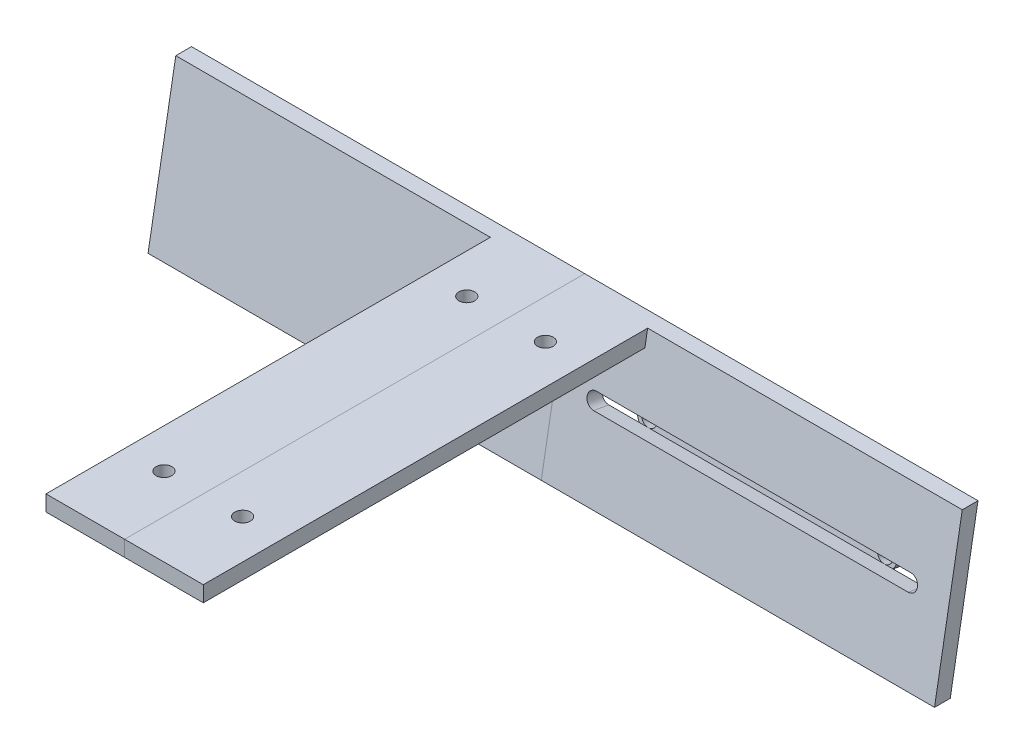
from build123d import *

# Parameters (mm, degrees)
BOSS_EXTRUDE1_DEPTH = 10
BOSS_EXTRUDE2_DEPTH = 50
SKETCH2_R           = 1
CUT_EXTRUDE1_DEPTH  = 50
CUT_EXTRUDE2_DEPTH  = 2
SKETCH3_3_R         = 1
BOSS_EXTRUDE3_DEPTH = 1.5
CUT_EXTRUDE3_DEPTH  = 0.2


with BuildPart() as part:
    # Sketch1 → Boss-Extrude1 (new body)
    with BuildSketch(Plane(origin=(0, 0, 0), x_dir=(0, 0, -1), z_dir=(1, 0, 0))):
        Polygon((-52.973460386, 18), (3.173885653, 18), (3.526539614, 20), (-52.973460386, 20), align=None)
    extrude(amount=BOSS_EXTRUDE1_DEPTH)

    # Sketch1<3> → Boss-Extrude2 (add)
    with BuildSketch(Plane(origin=(0, 0, 0), x_dir=(0, 0, -1), z_dir=(1, 0, 0))):
        Polygon((3.173885653, 18), (0, 0), (2, 0), (5.526539614, 20), (3.526539614, 20), align=None)
    extrude(amount=BOSS_EXTRUDE2_DEPTH)

    # Sketch2 → Cut-Extrude1 (cut)
    with BuildSketch(Plane(origin=(0, 20, 0), x_dir=(1, 0, 0), z_dir=(0, 1, 0))):
        with Locations(Location((5, -42.973460386, 0), (0, 0, 270))):
            Circle(SKETCH2_R)
        with Locations(Location((5, -4.473460386, 0), (0, 0, 270))):
            Circle(SKETCH2_R)
    extrude(amount=-CUT_EXTRUDE1_DEPTH, mode=Mode.SUBTRACT)


with BuildPart() as body_2:
    # Mirror1: mirrored copy
    add(part.part.mirror(Plane(origin=(0, 0, 0), x_dir=(0, 0, 1), z_dir=(1, 0, 0))))


with BuildPart() as part_1:
    add(part.part)

    # Sketch3 → Cut-Extrude2 (cut)
    with BuildSketch(Plane(origin=(0, -0.342020143, -1.939692621), x_dir=(-1, 0, 0), z_dir=(0, -0.1736481776669341, -0.9848077530122075))):
        with BuildLine():
            ThreePointArc((-41.118033989, 9.501562474), (-41.5, 10.501562474), (-41.118033989, 11.501562474))
            Line((-41.118033989, 11.501562474), (-45, 11.501562474))
            ThreePointArc((-45, 11.501562474), (-46, 10.501562474), (-45, 9.501562474))
            Line((-45, 9.501562474), (-41.118033989, 9.501562474))
        make_face()
        with BuildLine():
            ThreePointArc((-40, 9.501562474), (-41, 10.501562474), (-40, 11.501562474))
            Line((-40, 11.501562474), (-41.118033989, 11.501562474))
            ThreePointArc((-41.118033989, 11.501562474), (-41.5, 10.501562474), (-41.118033989, 9.501562474))
            Line((-41.118033989, 9.501562474), (-40, 9.501562474))
        make_face()
        with BuildLine():
            Line((-38.881966011, 11.501562474), (-40, 11.501562474))
            ThreePointArc((-40, 11.501562474), (-39.292893219, 11.208669255), (-39, 10.501562474))
            ThreePointArc((-39, 10.501562474), (-39.292893219, 9.794455693), (-40, 9.501562474))
            Line((-40, 9.501562474), (-38.881966011, 9.501562474))
            ThreePointArc((-38.881966011, 9.501562474), (-38.598741462, 9.96632934), (-38.5, 10.501562474))
            ThreePointArc((-38.5, 10.501562474), (-38.598741462, 11.036795609), (-38.881966011, 11.501562474))
        make_face()
        with BuildLine():
            ThreePointArc((-39, 10.501562474), (-39.292893219, 11.208669255), (-40, 11.501562474))
            Line((-40, 11.501562474), (-40, 9.501562474))
            ThreePointArc((-40, 9.501562474), (-39.292893219, 9.794455693), (-39, 10.501562474))
        make_face()
        with BuildLine():
            Line((-40, 9.501562474), (-40, 11.501562474))
            ThreePointArc((-40, 11.501562474), (-41, 10.501562474), (-40, 9.501562474))
        make_face()
        with BuildLine():
            Line((-11.118033989, 11.501562474), (-38.881966011, 11.501562474))
            ThreePointArc((-38.881966011, 11.501562474), (-38.598741462, 11.036795609), (-38.5, 10.501562474))
            ThreePointArc((-38.5, 10.501562474), (-38.598741462, 9.96632934), (-38.881966011, 9.501562474))
            Line((-38.881966011, 9.501562474), (-11.118033989, 9.501562474))
            ThreePointArc((-11.118033989, 9.501562474), (-11.5, 10.501562474), (-11.118033989, 11.501562474))
        make_face()
        with BuildLine():
            ThreePointArc((-10, 9.501562474), (-11, 10.501562477), (-9.999999995, 11.501562474))
            Line((-9.999999995, 11.501562474), (-11.118033989, 11.501562474))
            ThreePointArc((-11.118033989, 11.501562474), (-11.5, 10.501562474), (-11.118033989, 9.501562474))
            Line((-11.118033989, 9.501562474), (-10, 9.501562474))
        make_face()
        with BuildLine():
            Line((-8.881966011, 11.501562474), (-9.999999995, 11.501562474))
            ThreePointArc((-9.999999995, 11.501562474), (-9.292893217, 11.208669254), (-9, 10.501562474))
            ThreePointArc((-9, 10.501562474), (-9.292893219, 9.794455693), (-10, 9.501562474))
            Line((-10, 9.501562474), (-8.881966011, 9.501562474))
            ThreePointArc((-8.881966011, 9.501562474), (-8.598741462, 9.96632934), (-8.5, 10.501562474))
            ThreePointArc((-8.5, 10.501562474), (-8.598741462, 11.036795609), (-8.881966011, 11.501562474))
        make_face()
        with BuildLine():
            ThreePointArc((-9, 10.501562474), (-9.292893217, 11.208669254), (-9.999999995, 11.501562474))
            Line((-10, 11.501562474), (-10, 9.501562474))
            ThreePointArc((-10, 9.501562474), (-9.292893219, 9.794455693), (-9, 10.501562474))
        make_face()
        with BuildLine():
            Line((-10, 9.501562474), (-10, 11.501562474))
            ThreePointArc((-9.999999995, 11.501562474), (-11, 10.501562477), (-10, 9.501562474))
        make_face()
        with BuildLine():
            Line((-5, 11.501562474), (-8.881966011, 11.501562474))
            ThreePointArc((-8.881966011, 11.501562474), (-8.598741462, 11.036795609), (-8.5, 10.501562474))
            ThreePointArc((-8.5, 10.501562474), (-8.598741462, 9.96632934), (-8.881966011, 9.501562474))
            Line((-8.881966011, 9.501562474), (-5, 9.501562474))
            ThreePointArc((-5, 9.501562474), (-4, 10.501562474), (-5, 11.501562474))
        make_face()
    extrude(amount=-CUT_EXTRUDE2_DEPTH, mode=Mode.SUBTRACT)


with BuildPart() as body_3:
    # Sketch3<3> → Boss-Extrude3 (new body)
    with BuildSketch(Plane(origin=(0, -0.342020143, -1.939692621), x_dir=(-1, 0, 0), z_dir=(0, -0.1736481776669341, -0.9848077530122075))):
        with BuildLine():
            ThreePointArc((-10, 9.001562474), (-8.5, 10.501562474), (-10, 12.001562474))
            Line((-10, 12.001562474), (-10, 16.501562474))
            Line((-10, 16.501562474), (-40, 16.501562474))
            Line((-40, 16.501562474), (-40, 12.001562474))
            ThreePointArc((-40, 12.001562474), (-41.5, 10.501562474), (-40, 9.001562474))
            Line((-40, 9.001562474), (-40, 4.501562474))
            Line((-40, 4.501562474), (-10, 4.501562474))
            Line((-10, 4.501562474), (-10, 9.001562474))
        make_face()
        with Locations(Location((-40, 10.501562474, 0), (0, 0, 90))):
            Circle(SKETCH3_3_R, mode=Mode.SUBTRACT)
        with Locations(Location((-10, 10.501562474, 0), (0, 0, 90))):
            Circle(SKETCH3_3_R, mode=Mode.SUBTRACT)
    extrude(amount=BOSS_EXTRUDE3_DEPTH)

    # Sketch4 → Cut-Extrude3 (cut)
    # profile 1 of 6: a face of its own
    with BuildSketch(Plane(origin=(0, -0.60249241, -3.41690425), x_dir=(-1, 0, 0), z_dir=(0, -0.17364817766693416, -0.9848077530122075))):
        with BuildLine():
            Line((-39.91025641, 5.176742763), (-39.614383013, 5.354126577))
            add(Edge.make_bspline(
                [(-39.614383013, 5.354126577), (-39.586864776, 5.308062192), (-39.534140895, 5.219804608), (-39.446189536, 5.100546567), (-39.355056625, 4.999184411), (-39.260067291, 4.916307803), (-39.161801343, 4.851058916), (-39.059617289, 4.804856685), (-38.953859479, 4.776040709), (-38.881885657, 4.772540623), (-38.845953526, 4.770793243)],
                knots=[0, 0, 0, 0, 1.272034388, 2.437168799, 3.508375237, 4.49857839, 5.41946034, 6.295179144, 7.148887113, 8, 8, 8, 8], degree=3))
            add(Edge.make_bspline(
                [(-38.845953526, 4.770793243), (-38.815266665, 4.771647916), (-38.754429892, 4.773342306), (-38.664867649, 4.789623108), (-38.577885847, 4.814635237), (-38.495277209, 4.850456169), (-38.418181595, 4.893794654), (-38.350574899, 4.946140832), (-38.292128786, 5.004747038), (-38.244319672, 5.070129692), (-38.207639636, 5.140446841), (-38.179447568, 5.212622792), (-38.163802494, 5.28779136), (-38.161445741, 5.338401823), (-38.16025641, 5.363942282)],
                knots=[0, 0, 0, 0, 1.095163259, 2.171163733, 3.241058638, 4.321873601, 5.38011039, 6.391990106, 7.366004449, 8.327778327, 9.272591725, 10.192022065, 11.087607919, 12, 12, 12, 12], degree=3))
            add(Edge.make_bspline(
                [(-38.16025641, 5.363942282), (-38.161730721, 5.393083132), (-38.164727779, 5.452322221), (-38.190059259, 5.539721874), (-38.229908506, 5.626214444), (-38.26667115, 5.679715709), (-38.285757212, 5.707491961)],
                knots=[0, 0, 0, 0, 0.938893495, 1.908633276, 2.914225137, 4, 4, 4, 4], degree=3))
            add(Edge.make_bspline(
                [(-38.285757212, 5.707491961), (-38.301427826, 5.727538785), (-38.33432632, 5.769624584), (-38.390883833, 5.832269819), (-38.457249947, 5.896888238), (-38.531153502, 5.965947295), (-38.615286591, 6.036235092), (-38.707014105, 6.11110337), (-38.808677964, 6.187704947), (-38.879977461, 6.239077512), (-38.916766827, 6.26558491)],
                knots=[0, 0, 0, 0, 0.722233717, 1.516239348, 2.393582979, 3.351407094, 4.387010283, 5.505090956, 6.712668013, 8, 8, 8, 8], degree=3))
            add(Edge.make_bspline(
                [(-38.916766827, 6.26558491), (-38.953590823, 6.291813498), (-39.0239955, 6.34196056), (-39.122454082, 6.416384844), (-39.210498545, 6.484428714), (-39.287737562, 6.546732726), (-39.354137158, 6.60330533), (-39.410220569, 6.653603269), (-39.454559127, 6.69898683), (-39.479214707, 6.728428172), (-39.490284455, 6.741646609)],
                knots=[0, 0, 0, 0, 1.452282411, 2.77665338, 3.964542531, 5.026858415, 5.96415736, 6.766646006, 7.446254459, 8, 8, 8, 8], degree=3))
            add(Edge.make_bspline(
                [(-39.490284455, 6.741646609), (-39.505757, 6.762247646), (-39.536185837, 6.802762349), (-39.576351843, 6.866087207), (-39.610491005, 6.930910473), (-39.637253337, 6.997406337), (-39.659789556, 7.064641266), (-39.674947487, 7.133492512), (-39.684438884, 7.20365113), (-39.68541087, 7.250864631), (-39.685897436, 7.274499173)],
                knots=[0, 0, 0, 0, 1.068054152, 2.10047183, 3.106115577, 4.101338837, 5.06977816, 6.043150881, 7.020423561, 8, 8, 8, 8], degree=3))
            add(Edge.make_bspline(
                [(-39.685897436, 7.274499173), (-39.684592227, 7.311528947), (-39.682009707, 7.384797011), (-39.66016919, 7.491827842), (-39.625696296, 7.594014259), (-39.577401408, 7.690344593), (-39.515144055, 7.778310573), (-39.443098081, 7.85892406), (-39.357286595, 7.926692643), (-39.263133971, 7.985904701), (-39.160077599, 8.032250626), (-39.052086696, 8.067211606), (-38.938989624, 8.087020864), (-38.862386489, 8.089863629), (-38.823517628, 8.091306064)],
                knots=[0, 0, 0, 0, 1.005424448, 1.989358655, 2.955360095, 3.929531133, 4.905563448, 5.876582895, 6.856512386, 7.866279853, 8.892233794, 9.918561126, 10.94386622, 12, 12, 12, 12], degree=3))
            add(Edge.make_bspline(
                [(-38.823517628, 8.091306064), (-38.782273528, 8.089883512), (-38.700252176, 8.087054511), (-38.579602961, 8.06245698), (-38.463442244, 8.021756308), (-38.369998979, 7.97556765), (-38.296866218, 7.929436234), (-38.241093485, 7.88741641), (-38.184576034, 7.839041302), (-38.12685798, 7.784182055), (-38.06891732, 7.722335304), (-38.009893868, 7.653924615), (-37.949649599, 7.57936806), (-37.910893739, 7.526143559), (-37.891025641, 7.498858147)],
                knots=[0, 0, 0, 0, 1.286793592, 2.559021753, 3.825965368, 5.121522368, 5.803751409, 6.523245864, 7.299691795, 8.125521123, 9.008227632, 9.944561021, 10.946284179, 12, 12, 12, 12], degree=3))
            Line((-37.891025641, 7.498858147), (-38.174979968, 7.283613756))
            add(Edge.make_bspline(
                [(-38.174979968, 7.283613756), (-38.1921259, 7.305702447), (-38.225144957, 7.3482401), (-38.275274444, 7.407811415), (-38.322523092, 7.462227895), (-38.369073492, 7.509493023), (-38.412467124, 7.552195156), (-38.454584166, 7.588754913), (-38.494818517, 7.619530509), (-38.545535428, 7.652374069), (-38.609253146, 7.684930572), (-38.689237682, 7.71247965), (-38.772823957, 7.729034712), (-38.829753589, 7.7312236), (-38.858573718, 7.732331705)],
                knots=[0, 0, 0, 0, 1.181633172, 2.275549214, 3.290209073, 4.226197932, 5.078386478, 5.862611352, 6.581680152, 7.217281963, 8.414376989, 9.595101626, 10.782541182, 12, 12, 12, 12], degree=3))
            add(Edge.make_bspline(
                [(-38.858573718, 7.732331705), (-38.89473024, 7.731120005), (-38.964454688, 7.728783356), (-39.063444924, 7.703263371), (-39.152538849, 7.66308151), (-39.229091414, 7.606766532), (-39.292828391, 7.540045539), (-39.33893385, 7.463266684), (-39.366684014, 7.378484282), (-39.370070294, 7.319342625), (-39.371794872, 7.289222731)],
                knots=[0, 0, 0, 0, 1.14458467, 2.207223713, 3.21896685, 4.227309161, 5.202851033, 6.127160689, 7.046193047, 8, 8, 8, 8], degree=3))
            add(Edge.make_bspline(
                [(-39.371794872, 7.289222731), (-39.371401745, 7.270471252), (-39.370614849, 7.232937633), (-39.359640051, 7.177486211), (-39.345540722, 7.122174871), (-39.323198091, 7.067252288), (-39.292352787, 7.011757929), (-39.251847611, 6.954736192), (-39.200834299, 6.895684483), (-39.161757287, 6.857277109), (-39.141125801, 6.836999173)],
                knots=[0, 0, 0, 0, 0.858281714, 1.717966888, 2.583508476, 3.4729293, 4.427298488, 5.488583878, 6.674047936, 8, 8, 8, 8], degree=3))
            add(Edge.make_bspline(
                [(-39.141125801, 6.836999173), (-39.133464429, 6.830162147), (-39.115262762, 6.813918939), (-39.081986836, 6.787326658), (-39.038044038, 6.754523886), (-38.984581837, 6.713936569), (-38.920614475, 6.666855107), (-38.846134919, 6.613881495), (-38.761973386, 6.553296036), (-38.70225147, 6.510938495), (-38.670673077, 6.488541641)],
                knots=[0, 0, 0, 0, 0.420754252, 0.999615792, 1.744751191, 2.668019286, 3.750313428, 4.999500688, 6.413464383, 8, 8, 8, 8], degree=3))
            add(Edge.make_bspline(
                [(-38.670673077, 6.488541641), (-38.632687164, 6.460900281), (-38.559132707, 6.40737662), (-38.454475127, 6.32696094), (-38.359581319, 6.248313171), (-38.274118116, 6.171935564), (-38.197241207, 6.098407471), (-38.129803487, 6.026844291), (-38.071117806, 5.957758718), (-38.007938588, 5.869186142), (-37.943380768, 5.760405058), (-37.887939261, 5.627126819), (-37.852980913, 5.493330499), (-37.848409398, 5.403403662), (-37.846153846, 5.359034429)],
                knots=[0, 0, 0, 0, 1.163667725, 2.253281268, 3.268753668, 4.215851969, 5.092017293, 5.902905408, 6.650798638, 7.335211899, 8.59617414, 9.77448103, 10.901945474, 12, 12, 12, 12], degree=3))
            add(Edge.make_bspline(
                [(-37.846153846, 5.359034429), (-37.846810984, 5.327656064), (-37.848112499, 5.265508681), (-37.863073413, 5.174253604), (-37.884993078, 5.085622734), (-37.918030312, 5.000711622), (-37.95835347, 4.917966859), (-38.009519718, 4.839558959), (-38.068827403, 4.76375256), (-38.136861168, 4.692569069), (-38.21130707, 4.627222873), (-38.289990765, 4.569093811), (-38.373041038, 4.520625488), (-38.460007355, 4.481074646), (-38.550909691, 4.450141128), (-38.645717475, 4.427728259), (-38.744586986, 4.413972548), (-38.811787468, 4.412544787), (-38.845953526, 4.411818884)],
                knots=[0, 0, 0, 0, 0.983748083, 1.948392443, 2.894712957, 3.844097841, 4.80183111, 5.778335162, 6.776009319, 7.81870978, 8.863265674, 9.881300176, 10.883814829, 11.87499822, 12.874611388, 13.892143829, 14.928324115, 16, 16, 16, 16], degree=3))
            add(Edge.make_bspline(
                [(-38.845953526, 4.411818884), (-38.872388869, 4.412330066), (-38.924926629, 4.413345991), (-39.002636111, 4.422327272), (-39.0787757, 4.435034375), (-39.152389982, 4.455208445), (-39.224427393, 4.479685422), (-39.294574628, 4.509823755), (-39.362865682, 4.545940957), (-39.429683265, 4.587235981), (-39.494857439, 4.635293726), (-39.557776907, 4.691267222), (-39.620506093, 4.753612727), (-39.681193489, 4.82402329), (-39.741066633, 4.901361373), (-39.798945043, 4.986350557), (-39.856026761, 5.078527911), (-39.891842228, 5.143392996), (-39.91025641, 5.176742763)],
                knots=[0, 0, 0, 0, 0.915332311, 1.819136955, 2.706846663, 3.586547465, 4.459518054, 5.340707479, 6.227863349, 7.133153174, 8.059268498, 9.028702269, 10.047606654, 11.120612155, 12.245963614, 13.433783089, 14.680604001, 16, 16, 16, 16], degree=3))
        make_face()
    # profile 2 of 6: a face of its own
    with BuildSketch(Plane(origin=(0, -0.60249241, -3.41690425), x_dir=(-1, 0, 0), z_dir=(0, -0.17364817766693416, -0.9848077530122075))):
        Polygon((-37.128205128, 8.001562474), (-35.153846154, 8.001562474), (-35.153846154, 7.642588115), (-36.814102564, 7.642588115), (-36.814102564, 6.565665038), (-35.153846154, 6.565665038), (-35.153846154, 6.206690679), (-36.814102564, 6.206690679), (-36.814102564, 4.860536833), (-35.153846154, 4.860536833), (-35.153846154, 4.501562474), (-37.128205128, 4.501562474), align=None)
    # profile 3 of 6: a face of its own
    with BuildSketch(Plane(origin=(0, -0.60249241, -3.41690425), x_dir=(-1, 0, 0), z_dir=(0, -0.17364817766693416, -0.9848077530122075))):
        Polygon((-34.525641026, 4.501562474), (-34.525641026, 8.001562474), (-34.459735577, 8.001562474), (-32.147435897, 5.246854942), (-32.147435897, 8.001562474), (-31.833333333, 8.001562474), (-31.833333333, 4.501562474), (-31.904847756, 4.501562474), (-34.211538462, 7.24995991), (-34.211538462, 4.501562474), align=None)
    # profile 4 of 6: a face of its own
    with BuildSketch(Plane(origin=(0, -0.60249241, -3.41690425), x_dir=(-1, 0, 0), z_dir=(0, -0.17364817766693416, -0.9848077530122075))):
        with BuildLine():
            Line((-31.294871795, 5.176742763), (-30.998998397, 5.354126577))
            add(Edge.make_bspline(
                [(-30.998998397, 5.354126577), (-30.97148016, 5.308062192), (-30.91875628, 5.219804608), (-30.83080492, 5.100546567), (-30.739672009, 4.999184411), (-30.644682676, 4.916307803), (-30.546416728, 4.851058916), (-30.444232674, 4.804856685), (-30.338474863, 4.776040709), (-30.266501042, 4.772540623), (-30.23056891, 4.770793243)],
                knots=[0, 0, 0, 0, 1.272034388, 2.437168799, 3.508375237, 4.49857839, 5.41946034, 6.295179144, 7.148887113, 8, 8, 8, 8], degree=3))
            add(Edge.make_bspline(
                [(-30.23056891, 4.770793243), (-30.19988205, 4.771647916), (-30.139045277, 4.773342306), (-30.049483034, 4.789623108), (-29.962501231, 4.814635237), (-29.879892594, 4.850456169), (-29.802796979, 4.893794654), (-29.735190284, 4.946140832), (-29.676744171, 5.004747038), (-29.628935056, 5.070129692), (-29.592255021, 5.140446841), (-29.564062952, 5.212622792), (-29.548417879, 5.28779136), (-29.546061125, 5.338401823), (-29.544871795, 5.363942282)],
                knots=[0, 0, 0, 0, 1.095163259, 2.171163733, 3.241058638, 4.321873601, 5.38011039, 6.391990106, 7.366004449, 8.327778327, 9.272591725, 10.192022065, 11.087607919, 12, 12, 12, 12], degree=3))
            add(Edge.make_bspline(
                [(-29.544871795, 5.363942282), (-29.546346106, 5.393083132), (-29.549343164, 5.452322221), (-29.574674644, 5.539721874), (-29.614523891, 5.626214444), (-29.651286534, 5.679715709), (-29.670372596, 5.707491961)],
                knots=[0, 0, 0, 0, 0.938893495, 1.908633276, 2.914225137, 4, 4, 4, 4], degree=3))
            add(Edge.make_bspline(
                [(-29.670372596, 5.707491961), (-29.68604321, 5.727538785), (-29.718941705, 5.769624584), (-29.775499217, 5.832269819), (-29.841865332, 5.896888238), (-29.915768886, 5.965947295), (-29.999901975, 6.036235092), (-30.09162949, 6.11110337), (-30.193293349, 6.187704947), (-30.264592845, 6.239077512), (-30.301382212, 6.26558491)],
                knots=[0, 0, 0, 0, 0.722233717, 1.516239348, 2.393582979, 3.351407094, 4.387010283, 5.505090956, 6.712668013, 8, 8, 8, 8], degree=3))
            add(Edge.make_bspline(
                [(-30.301382212, 6.26558491), (-30.338206208, 6.291813498), (-30.408610884, 6.34196056), (-30.507069467, 6.416384844), (-30.59511393, 6.484428714), (-30.672352946, 6.546732726), (-30.738752543, 6.60330533), (-30.794835954, 6.653603269), (-30.839174511, 6.69898683), (-30.863830092, 6.728428172), (-30.87489984, 6.741646609)],
                knots=[0, 0, 0, 0, 1.452282411, 2.77665338, 3.964542531, 5.026858415, 5.96415736, 6.766646006, 7.446254459, 8, 8, 8, 8], degree=3))
            add(Edge.make_bspline(
                [(-30.87489984, 6.741646609), (-30.890372385, 6.762247646), (-30.920801222, 6.802762349), (-30.960967227, 6.866087207), (-30.99510639, 6.930910473), (-31.021868722, 6.997406337), (-31.044404941, 7.064641266), (-31.059562872, 7.133492512), (-31.069054269, 7.20365113), (-31.070026255, 7.250864631), (-31.070512821, 7.274499173)],
                knots=[0, 0, 0, 0, 1.068054152, 2.10047183, 3.106115577, 4.101338837, 5.06977816, 6.043150881, 7.020423561, 8, 8, 8, 8], degree=3))
            add(Edge.make_bspline(
                [(-31.070512821, 7.274499173), (-31.069207612, 7.311528947), (-31.066625091, 7.384797011), (-31.044784574, 7.491827842), (-31.010311681, 7.594014259), (-30.962016793, 7.690344593), (-30.89975944, 7.778310573), (-30.827713465, 7.85892406), (-30.741901979, 7.926692643), (-30.647749356, 7.985904701), (-30.544692984, 8.032250626), (-30.43670208, 8.067211606), (-30.323605008, 8.087020864), (-30.247001874, 8.089863629), (-30.208133013, 8.091306064)],
                knots=[0, 0, 0, 0, 1.005424448, 1.989358655, 2.955360095, 3.929531133, 4.905563448, 5.876582895, 6.856512386, 7.866279853, 8.892233794, 9.918561126, 10.94386622, 12, 12, 12, 12], degree=3))
            add(Edge.make_bspline(
                [(-30.208133013, 8.091306064), (-30.166888913, 8.089883512), (-30.084867561, 8.087054511), (-29.964218345, 8.06245698), (-29.848057629, 8.021756308), (-29.754614364, 7.97556765), (-29.681481603, 7.929436234), (-29.62570887, 7.88741641), (-29.569191419, 7.839041302), (-29.511473364, 7.784182055), (-29.453532705, 7.722335304), (-29.394509253, 7.653924615), (-29.334264984, 7.57936806), (-29.295509124, 7.526143559), (-29.275641026, 7.498858147)],
                knots=[0, 0, 0, 0, 1.286793592, 2.559021753, 3.825965368, 5.121522368, 5.803751409, 6.523245864, 7.299691795, 8.125521123, 9.008227632, 9.944561021, 10.946284179, 12, 12, 12, 12], degree=3))
            Line((-29.275641026, 7.498858147), (-29.559595353, 7.283613756))
            add(Edge.make_bspline(
                [(-29.559595353, 7.283613756), (-29.576741285, 7.305702447), (-29.609760342, 7.3482401), (-29.659889829, 7.407811415), (-29.707138477, 7.462227895), (-29.753688877, 7.509493023), (-29.797082508, 7.552195156), (-29.83919955, 7.588754913), (-29.879433902, 7.619530509), (-29.930150812, 7.652374069), (-29.993868531, 7.684930572), (-30.073853067, 7.71247965), (-30.157439342, 7.729034712), (-30.214368973, 7.7312236), (-30.243189103, 7.732331705)],
                knots=[0, 0, 0, 0, 1.181633172, 2.275549214, 3.290209073, 4.226197932, 5.078386478, 5.862611352, 6.581680152, 7.217281963, 8.414376989, 9.595101626, 10.782541182, 12, 12, 12, 12], degree=3))
            add(Edge.make_bspline(
                [(-30.243189103, 7.732331705), (-30.279345625, 7.731120005), (-30.349070072, 7.728783356), (-30.448060308, 7.703263371), (-30.537154234, 7.66308151), (-30.613706799, 7.606766532), (-30.677443776, 7.540045539), (-30.723549234, 7.463266684), (-30.751299399, 7.378484282), (-30.754685679, 7.319342625), (-30.756410256, 7.289222731)],
                knots=[0, 0, 0, 0, 1.14458467, 2.207223713, 3.21896685, 4.227309161, 5.202851033, 6.127160689, 7.046193047, 8, 8, 8, 8], degree=3))
            add(Edge.make_bspline(
                [(-30.756410256, 7.289222731), (-30.75601713, 7.270471252), (-30.755230234, 7.232937633), (-30.744255436, 7.177486211), (-30.730156107, 7.122174871), (-30.707813475, 7.067252288), (-30.676968172, 7.011757929), (-30.636462996, 6.954736192), (-30.585449684, 6.895684483), (-30.546372671, 6.857277109), (-30.525741186, 6.836999173)],
                knots=[0, 0, 0, 0, 0.858281714, 1.717966888, 2.583508476, 3.4729293, 4.427298488, 5.488583878, 6.674047936, 8, 8, 8, 8], degree=3))
            add(Edge.make_bspline(
                [(-30.525741186, 6.836999173), (-30.518079813, 6.830162147), (-30.499878146, 6.813918939), (-30.466602221, 6.787326658), (-30.422659422, 6.754523886), (-30.369197221, 6.713936569), (-30.305229859, 6.666855107), (-30.230750303, 6.613881495), (-30.14658877, 6.553296036), (-30.086866855, 6.510938495), (-30.055288462, 6.488541641)],
                knots=[0, 0, 0, 0, 0.420754252, 0.999615792, 1.744751191, 2.668019286, 3.750313428, 4.999500688, 6.413464383, 8, 8, 8, 8], degree=3))
            add(Edge.make_bspline(
                [(-30.055288462, 6.488541641), (-30.017302548, 6.460900281), (-29.943748092, 6.40737662), (-29.839090512, 6.32696094), (-29.744196704, 6.248313171), (-29.6587335, 6.171935564), (-29.581856592, 6.098407471), (-29.514418871, 6.026844291), (-29.455733191, 5.957758718), (-29.392553972, 5.869186142), (-29.327996153, 5.760405058), (-29.272554645, 5.627126819), (-29.237596298, 5.493330499), (-29.233024783, 5.403403662), (-29.230769231, 5.359034429)],
                knots=[0, 0, 0, 0, 1.163667725, 2.253281268, 3.268753668, 4.215851969, 5.092017293, 5.902905408, 6.650798638, 7.335211899, 8.59617414, 9.77448103, 10.901945474, 12, 12, 12, 12], degree=3))
            add(Edge.make_bspline(
                [(-29.230769231, 5.359034429), (-29.231426369, 5.327656064), (-29.232727884, 5.265508681), (-29.247688798, 5.174253604), (-29.269608463, 5.085622734), (-29.302645697, 5.000711622), (-29.342968855, 4.917966859), (-29.394135103, 4.839558959), (-29.453442788, 4.76375256), (-29.521476553, 4.692569069), (-29.595922455, 4.627222873), (-29.67460615, 4.569093811), (-29.757656423, 4.520625488), (-29.844622739, 4.481074646), (-29.935525076, 4.450141128), (-30.03033286, 4.427728259), (-30.129202371, 4.413972548), (-30.196402853, 4.412544787), (-30.23056891, 4.411818884)],
                knots=[0, 0, 0, 0, 0.983748083, 1.948392443, 2.894712957, 3.844097841, 4.80183111, 5.778335162, 6.776009319, 7.81870978, 8.863265674, 9.881300176, 10.883814829, 11.87499822, 12.874611388, 13.892143829, 14.928324115, 16, 16, 16, 16], degree=3))
            add(Edge.make_bspline(
                [(-30.23056891, 4.411818884), (-30.257004253, 4.412330066), (-30.309542013, 4.413345991), (-30.387251495, 4.422327272), (-30.463391084, 4.435034375), (-30.537005366, 4.455208445), (-30.609042778, 4.479685422), (-30.679190013, 4.509823755), (-30.747481066, 4.545940957), (-30.814298649, 4.587235981), (-30.879472824, 4.635293726), (-30.942392292, 4.691267222), (-31.005121477, 4.753612727), (-31.065808874, 4.82402329), (-31.125682018, 4.901361373), (-31.183560427, 4.986350557), (-31.240642145, 5.078527911), (-31.276457613, 5.143392996), (-31.294871795, 5.176742763)],
                knots=[0, 0, 0, 0, 0.915332311, 1.819136955, 2.706846663, 3.586547465, 4.459518054, 5.340707479, 6.227863349, 7.133153174, 8.059268498, 9.028702269, 10.047606654, 11.120612155, 12.245963614, 13.433783089, 14.680604001, 16, 16, 16, 16], degree=3))
        make_face()
    # profile 5 of 6: a face of its own
    with BuildSketch(Plane(origin=(0, -0.60249241, -3.41690425), x_dir=(-1, 0, 0), z_dir=(0, -0.17364817766693416, -0.9848077530122075))):
        with BuildLine():
            add(Edge.make_bspline(
                [(-26.875, 8.091306064), (-26.810191894, 8.089664585), (-26.682903427, 8.086440584), (-26.495828529, 8.06176148), (-26.317233434, 8.01906609), (-26.145663295, 7.962203108), (-25.983170319, 7.886348722), (-25.828531426, 7.794663574), (-25.682114552, 7.686187115), (-25.545893171, 7.561757888), (-25.421236221, 7.426374434), (-25.311410334, 7.281896524), (-25.219368041, 7.129197722), (-25.143782253, 6.968736891), (-25.084483644, 6.800876923), (-25.0435646, 6.624722921), (-25.01742645, 6.441416231), (-25.014370673, 6.316389366), (-25.012820513, 6.252964718)],
                knots=[0, 0, 0, 0, 1.065120563, 2.091984664, 3.0946048, 4.079830382, 5.057816894, 6.036188127, 7.030412546, 8.04752943, 9.064399622, 10.05169764, 11.02544977, 11.989514704, 12.962713494, 13.945757189, 14.957906945, 16, 16, 16, 16], degree=3))
            add(Edge.make_bspline(
                [(-25.012820513, 6.252964718), (-25.014370445, 6.190007271), (-25.017425542, 6.065910851), (-25.043594319, 5.883767407), (-25.084635319, 5.70867671), (-25.143231586, 5.540931058), (-25.218457064, 5.380353494), (-25.311112235, 5.22736654), (-25.420253446, 5.081920042), (-25.544460297, 4.945607376), (-25.679861339, 4.820609906), (-25.825091606, 4.71169103), (-25.976884926, 4.617966905), (-26.137194634, 4.543183231), (-26.303894671, 4.483411311), (-26.478476994, 4.442658681), (-26.660123548, 4.416371638), (-26.783994552, 4.413353122), (-26.846955128, 4.411818884)],
                knots=[0, 0, 0, 0, 1.043624062, 2.057103931, 3.04512605, 4.022047818, 4.998200453, 5.980619268, 6.982898556, 8.009068085, 9.034988726, 10.034168286, 11.015286542, 11.987931943, 12.962482838, 13.94673481, 14.956375938, 16, 16, 16, 16], degree=3))
            add(Edge.make_bspline(
                [(-26.846955128, 4.411818884), (-26.910379447, 4.413368271), (-27.035405663, 4.416422525), (-27.218942699, 4.44260393), (-27.395220442, 4.483545234), (-27.563734794, 4.54205467), (-27.724579723, 4.617671901), (-27.878069806, 4.70987628), (-28.023588953, 4.819283421), (-28.1599307, 4.943449996), (-28.284679898, 5.078621548), (-28.393439273, 5.223455803), (-28.485664387, 5.375111259), (-28.561027719, 5.534008783), (-28.620692179, 5.699380226), (-28.661396997, 5.872328704), (-28.687732949, 6.051868209), (-28.690767795, 6.174111108), (-28.692307692, 6.236137795)],
                knots=[0, 0, 0, 0, 1.053102029, 2.075944431, 3.073151272, 4.055350789, 5.033113405, 6.020478099, 7.024410459, 8.052272461, 9.079885166, 10.07527673, 11.055994387, 12.023226415, 12.992069828, 13.970394897, 14.97016774, 16, 16, 16, 16], degree=3))
            add(Edge.make_bspline(
                [(-28.692307692, 6.236137795), (-28.691773057, 6.277770464), (-28.69071053, 6.360510587), (-28.677918838, 6.483377187), (-28.659357137, 6.604267845), (-28.632755224, 6.722838793), (-28.597963557, 6.838799778), (-28.55691153, 6.952950541), (-28.506771684, 7.064134265), (-28.450091036, 7.172877656), (-28.386829228, 7.277485562), (-28.316953479, 7.376365145), (-28.242918111, 7.470346142), (-28.161754717, 7.556993146), (-28.076138272, 7.638826802), (-27.984679894, 7.714589519), (-27.887937649, 7.78496447), (-27.785495269, 7.848384811), (-27.679876995, 7.905743946), (-27.571000217, 7.954965797), (-27.460343645, 7.997211858), (-27.347388997, 8.031452684), (-27.232436225, 8.05848472), (-27.115234441, 8.076892073), (-26.995877014, 8.089716391), (-26.915465695, 8.090773893), (-26.875, 8.091306064)],
                knots=[0, 0, 0, 0, 1.037015668, 2.060948919, 3.074880161, 4.083647147, 5.086022904, 6.090072063, 7.104153813, 8.122640571, 9.144368836, 10.147691507, 11.138137339, 12.123020368, 13.103399296, 14.087645067, 15.080126199, 16.082011238, 17.087798457, 18.072939717, 19.057185487, 20.037253025, 21.01195951, 21.997135196, 22.992090687, 24, 24, 24, 24], degree=3))
        make_face()
        with BuildLine():
            add(Edge.make_bspline(
                [(-26.859575321, 7.732331705), (-26.892789954, 7.731926815), (-26.958901687, 7.731120905), (-27.057186223, 7.720505189), (-27.154178157, 7.7053753), (-27.249897519, 7.68379378), (-27.343943809, 7.654389727), (-27.43719365, 7.620548819), (-27.528796704, 7.579327728), (-27.618450562, 7.532755024), (-27.705365637, 7.481206103), (-27.787378338, 7.424234336), (-27.864700982, 7.363175782), (-27.937144249, 7.297887944), (-28.004495421, 7.228038342), (-28.068080122, 7.154685906), (-28.125349704, 7.075734015), (-28.177835281, 6.993323608), (-28.224803121, 6.907562027), (-28.266568476, 6.819352165), (-28.300732485, 6.727974478), (-28.328594861, 6.634420321), (-28.351694672, 6.538837861), (-28.366328596, 6.440502012), (-28.377060955, 6.3399069), (-28.377820801, 6.271925046), (-28.378205128, 6.237540038)],
                knots=[0, 0, 0, 0, 1.008559885, 2.007477868, 2.99961109, 3.989939068, 4.984837346, 5.991145699, 7.001802488, 8.033829008, 9.059044045, 10.069351652, 11.065060232, 12.050310815, 13.029377138, 14.011219647, 14.996725999, 15.989392538, 16.977580475, 17.965360261, 18.951710183, 19.937753436, 20.929683414, 21.935841486, 22.955955122, 24, 24, 24, 24], degree=3))
            add(Edge.make_bspline(
                [(-28.378205128, 6.237540038), (-28.376930266, 6.186977817), (-28.374422218, 6.087506287), (-28.352464648, 5.941738143), (-28.318642674, 5.801649857), (-28.268785307, 5.668007948), (-28.206434693, 5.539663665), (-28.129407802, 5.41775556), (-28.038148717, 5.302250686), (-27.93448519, 5.193955417), (-27.821162484, 5.095109613), (-27.700829754, 5.008346204), (-27.574776146, 4.934935954), (-27.442672944, 4.875130882), (-27.305225405, 4.827741144), (-27.161547853, 4.795262513), (-27.012597394, 4.773887057), (-26.911066739, 4.771834302), (-26.859575321, 4.770793243)],
                knots=[0, 0, 0, 0, 1.032063989, 2.030389145, 3.003944642, 3.970395727, 4.937377036, 5.913328081, 6.909231446, 7.93887556, 8.970685674, 9.976071282, 10.964166581, 11.944589148, 12.933237628, 13.927779006, 14.949070134, 16, 16, 16, 16], degree=3))
            add(Edge.make_bspline(
                [(-26.859575321, 4.770793243), (-26.824965819, 4.771268748), (-26.756324783, 4.772211816), (-26.65422926, 4.781710493), (-26.553973048, 4.796942362), (-26.455696769, 4.818873018), (-26.359511957, 4.846320224), (-26.265017154, 4.878927952), (-26.173218864, 4.919609156), (-26.082959026, 4.964557107), (-25.996562784, 5.015797265), (-25.914087252, 5.070835414), (-25.837611272, 5.131804035), (-25.765222201, 5.196121848), (-25.697594512, 5.265085696), (-25.635185527, 5.338605917), (-25.578205395, 5.417146575), (-25.525739749, 5.49943198), (-25.478936486, 5.585428233), (-25.438157387, 5.673957911), (-25.403561271, 5.76480302), (-25.375632766, 5.858094592), (-25.353747305, 5.953655441), (-25.338667385, 6.051613519), (-25.328118946, 6.151772861), (-25.327323869, 6.219516717), (-25.326923077, 6.25366584)],
                knots=[0, 0, 0, 0, 1.047197238, 2.076906641, 3.100256066, 4.114471768, 5.12198147, 6.126382909, 7.136867548, 8.15857795, 9.17633901, 10.174870724, 11.156907918, 12.133735059, 13.104061851, 14.077631395, 15.04955518, 16.038496417, 17.029181396, 18.010275684, 18.986308667, 19.968651475, 20.955262928, 21.950658345, 22.966943676, 24, 24, 24, 24], degree=3))
            add(Edge.make_bspline(
                [(-25.326923077, 6.25366584), (-25.32732419, 6.287581344), (-25.328119871, 6.354858994), (-25.338662346, 6.454319812), (-25.353763236, 6.551573024), (-25.375525944, 6.646236827), (-25.403576098, 6.738335352), (-25.438163429, 6.8277821), (-25.478948728, 6.914910295), (-25.525756952, 6.999504592), (-25.578372776, 7.08067933), (-25.635867019, 7.158281742), (-25.699232367, 7.230854484), (-25.766658392, 7.300189178), (-25.839829278, 7.364807067), (-25.918413572, 7.424729588), (-26.001457249, 7.481402862), (-26.089384485, 7.532528424), (-26.180128439, 7.579742657), (-26.273242397, 7.62019366), (-26.367671496, 7.654565779), (-26.463175608, 7.683882744), (-26.560558587, 7.705290774), (-26.659162416, 7.720518824), (-26.758850674, 7.73111721), (-26.825893894, 7.731925589), (-26.859575321, 7.732331705)],
                knots=[0, 0, 0, 0, 1.02996197, 2.043119294, 3.035359645, 4.018872909, 4.991431989, 5.957985074, 6.929999688, 7.912076566, 8.892894881, 9.867085534, 10.843653904, 11.817741046, 12.803660682, 13.806313499, 14.818574707, 15.856120519, 16.894564902, 17.924820532, 18.937903209, 19.946497019, 20.957711757, 21.963978472, 22.977135795, 24, 24, 24, 24], degree=3))
        make_face(mode=Mode.SUBTRACT)
    # profile 6 of 6: a face of its own
    with BuildSketch(Plane(origin=(0, -0.60249241, -3.41690425), x_dir=(-1, 0, 0), z_dir=(0, -0.17364817766693416, -0.9848077530122075))):
        with BuildLine():
            Line((-24.294871795, 8.001562474), (-23.594451122, 8.001562474))
            add(Edge.make_bspline(
                [(-23.594451122, 8.001562474), (-23.547709993, 8.001406888), (-23.457961849, 8.001108146), (-23.329388579, 7.999442383), (-23.212561482, 7.994668027), (-23.107541642, 7.990559444), (-23.014330987, 7.983067502), (-22.932643696, 7.975906855), (-22.862855999, 7.966533195), (-22.820610148, 7.957827772), (-22.801482372, 7.953886192)],
                knots=[0, 0, 0, 0, 1.410062039, 2.707475311, 3.878576406, 4.937260626, 5.877586885, 6.699081471, 7.410979367, 8, 8, 8, 8], degree=3))
            add(Edge.make_bspline(
                [(-22.801482372, 7.953886192), (-22.775875748, 7.947559427), (-22.725208758, 7.935040863), (-22.652258692, 7.908581262), (-22.582744368, 7.877961638), (-22.516954544, 7.841997917), (-22.455218753, 7.800423138), (-22.396900442, 7.753955015), (-22.341734979, 7.702847809), (-22.291953348, 7.645812968), (-22.245014297, 7.585976458), (-22.20542567, 7.521272701), (-22.17129919, 7.453611174), (-22.144128673, 7.382303756), (-22.1222507, 7.308041984), (-22.106824461, 7.230153188), (-22.097573273, 7.148992213), (-22.096631417, 7.093634304), (-22.096153846, 7.065564878)],
                knots=[0, 0, 0, 0, 1.027469482, 2.033020251, 3.019912614, 3.986113645, 4.951240523, 5.91722682, 6.890402269, 7.87763091, 8.8651537, 9.85103654, 10.82876324, 11.815024772, 12.821070561, 13.842952187, 14.906261191, 16, 16, 16, 16], degree=3))
            add(Edge.make_bspline(
                [(-22.096153846, 7.065564878), (-22.097622844, 7.018929773), (-22.10048924, 6.927932606), (-22.127214344, 6.795871724), (-22.170990863, 6.672682409), (-22.231314152, 6.558519772), (-22.308133628, 6.455609126), (-22.400458419, 6.365218671), (-22.508340031, 6.289578758), (-22.608769347, 6.237125954), (-22.697483546, 6.203533045), (-22.770516859, 6.179896686), (-22.850183837, 6.161634721), (-22.935721171, 6.145274589), (-23.027484827, 6.132922895), (-23.125254866, 6.1238763), (-23.229101018, 6.118222252), (-23.300440087, 6.117380247), (-23.337139423, 6.11694709)],
                knots=[0, 0, 0, 0, 1.260483769, 2.459530307, 3.627416485, 4.787058657, 5.939039949, 7.08810263, 8.267026773, 9.491475466, 10.141966685, 10.831826277, 11.566392101, 12.351337768, 13.187381173, 14.07005841, 15.007169909, 16, 16, 16, 16], degree=3))
            Line((-23.337139423, 6.11694709), (-22.051282051, 4.501562474))
            Line((-22.051282051, 4.501562474), (-22.439703526, 4.501562474))
            Line((-22.439703526, 4.501562474), (-23.725560897, 6.11694709))
            Line((-23.725560897, 6.11694709), (-23.980769231, 6.11694709))
            Line((-23.980769231, 6.11694709), (-23.980769231, 4.501562474))
            Line((-23.980769231, 4.501562474), (-24.294871795, 4.501562474))
            Line((-24.294871795, 4.501562474), (-24.294871795, 8.001562474))
        make_face()
        with BuildLine():
            Line((-23.980769231, 7.642588115), (-23.980769231, 6.475921449))
            Line((-23.980769231, 6.475921449), (-23.33994391, 6.471013596))
            add(Edge.make_bspline(
                [(-23.33994391, 6.471013596), (-23.310023871, 6.471000359), (-23.252030314, 6.470974703), (-23.168129649, 6.474968479), (-23.090009538, 6.479511797), (-23.017968786, 6.486461143), (-22.95197521, 6.495417215), (-22.892061797, 6.506620199), (-22.838130745, 6.519672262), (-22.775232207, 6.539873887), (-22.704995675, 6.571879906), (-22.628664215, 6.618445404), (-22.563661878, 6.677014523), (-22.508744015, 6.74398798), (-22.464614584, 6.817624228), (-22.43350253, 6.897040598), (-22.413760087, 6.980232196), (-22.411431542, 7.037410303), (-22.41025641, 7.066266)],
                knots=[0, 0, 0, 0, 1.146690395, 2.22261258, 3.21895312, 4.145990853, 4.996080663, 5.770904154, 6.481378293, 7.121626537, 8.300444488, 9.431385265, 10.535395872, 11.636531494, 12.74115979, 13.810798291, 14.895190096, 16, 16, 16, 16], degree=3))
            add(Edge.make_bspline(
                [(-22.41025641, 7.066266), (-22.411458531, 7.094412574), (-22.413840697, 7.150188812), (-22.433289465, 7.231844723), (-22.466178847, 7.308911673), (-22.510501085, 7.381076158), (-22.564500239, 7.446581894), (-22.627818052, 7.502629047), (-22.698723247, 7.548878511), (-22.764994446, 7.578432892), (-22.824228658, 7.596552745), (-22.875658318, 7.609303909), (-22.933769796, 7.619548378), (-22.998845255, 7.627756439), (-23.070606885, 7.634811383), (-23.149417536, 7.639563162), (-23.234754317, 7.642377026), (-23.293901248, 7.642516115), (-23.324519231, 7.642588115)],
                knots=[0, 0, 0, 0, 1.101028733, 2.181837193, 3.264309656, 4.369019818, 5.486613113, 6.575447106, 7.666700264, 8.788928104, 9.402425223, 10.0903467, 10.862060571, 11.710948788, 12.657782767, 13.684531032, 14.801375019, 16, 16, 16, 16], degree=3))
            Line((-23.324519231, 7.642588115), (-23.980769231, 7.642588115))
        make_face(mode=Mode.SUBTRACT)
    extrude(amount=-CUT_EXTRUDE3_DEPTH, mode=Mode.SUBTRACT)


solid = Compound([body_2.part, part_1.part, body_3.part])
